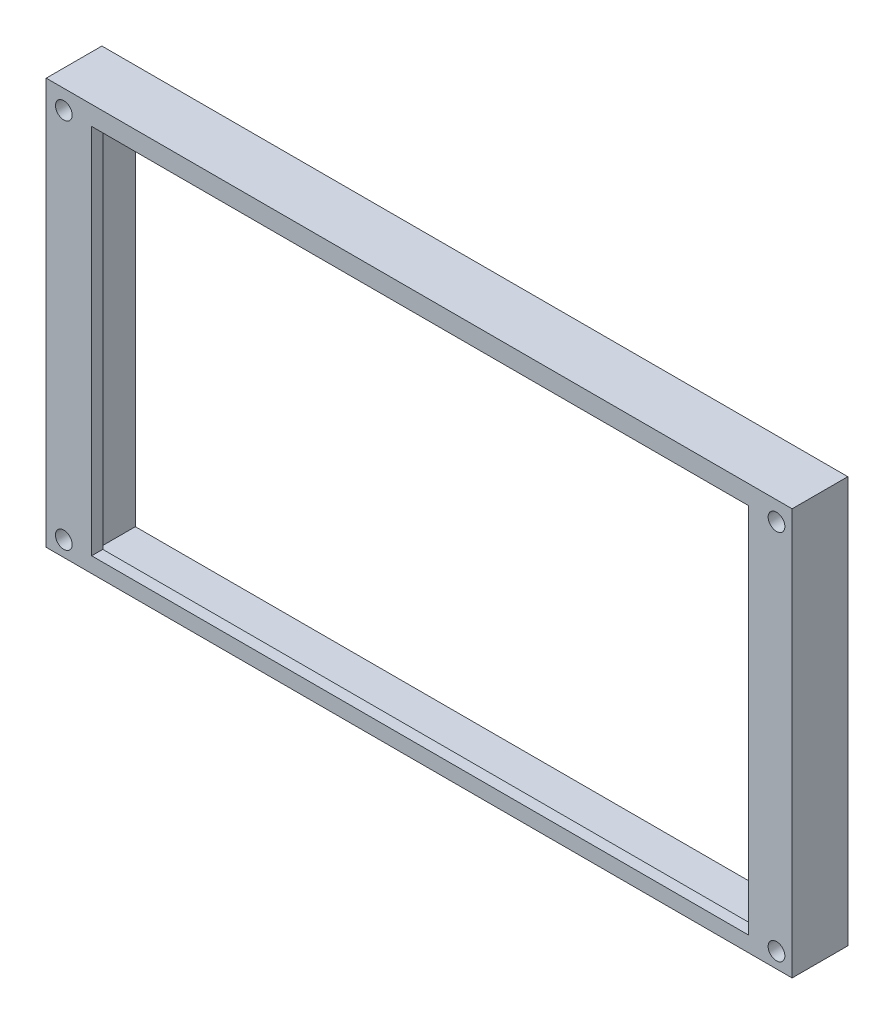
from build123d import *

# Parameters (mm, degrees)
SKETCH_1_W          = 126
SKETCH_1_H          = 73
SKETCH_1_W_2        = 122
SKETCH_1_H_2        = 70
EXTRUDE_1_DEPTH     = 8
SKETCH_5_W          = 126
SKETCH_5_H          = 73
SKETCH_5_W_2        = 118.02914008
SKETCH_5_H_2        = 66.805819456
EXTRUDE_2_DEPTH     = 2
SKETCH_7_W          = 4
SKETCH_7_H          = 73
EXTRUDE_3_DEPTH     = 2
SKETCH_8_W          = 4
SKETCH_8_H          = 73
EXTRUDE_5_DEPTH     = 2
SKETCH_10_W         = 4
SKETCH_10_H         = 73
EXTRUDE_6_DEPTH     = 5
SKETCH_12_W         = 4
SKETCH_12_H         = 73
EXTRUDE_7_DEPTH     = 3
CUT_EXTRUDE_1_DEPTH = 100.510141559


with BuildPart() as part:
    # 草图1 → 凸台-拉伸1 (new body)
    with BuildSketch(Plane.XY):
        with Locations((22.277543779, 6.299397776)):
            Rectangle(SKETCH_1_W, SKETCH_1_H)
        with Locations((22.29370516, 6.021928133)):
            Rectangle(SKETCH_1_W_2, SKETCH_1_H_2, mode=Mode.SUBTRACT)
    extrude(amount=-EXTRUDE_1_DEPTH)

    # 草图5 → 凸台-拉伸2 (add)
    with BuildSketch(Plane.XY):
        with Locations((22.277543779, 6.299397776)):
            Rectangle(SKETCH_5_W, SKETCH_5_H)
        with Locations((22.456070853, 5.970224549)):
            Rectangle(SKETCH_5_W_2, SKETCH_5_H_2, mode=Mode.SUBTRACT)
    extrude(amount=EXTRUDE_2_DEPTH)

    # 草图7 → 凸台-拉伸3 (add)
    with BuildSketch(Plane(origin=(0, 0, -8), x_dir=(-1, 0, 0), z_dir=(0, 0, -1))):
        with Locations((-87.277543779, 6.299397776)):
            Rectangle(SKETCH_7_W, SKETCH_7_H)
    extrude(amount=-EXTRUDE_3_DEPTH)

    # 草图8 → 凸台-拉伸5 (add)
    with BuildSketch(Plane(origin=(0, 0, -8), x_dir=(-1, 0, 0), z_dir=(0, 0, -1))):
        with Locations((42.722456221, 6.299397776)):
            Rectangle(SKETCH_8_W, SKETCH_8_H)
    extrude(amount=-EXTRUDE_5_DEPTH)

    # 草图10 → 凸台-拉伸6 (add)
    with BuildSketch(Plane.XY.offset(-6)):
        with Locations((87.277543779, 6.299397776)):
            Rectangle(SKETCH_10_W, SKETCH_10_H)
        with Locations((-42.722456221, 6.299397776)):
            Rectangle(SKETCH_10_W, SKETCH_10_H)
    extrude(amount=EXTRUDE_6_DEPTH)

    # 草图12 → 凸台-拉伸7 (add)
    with BuildSketch(Plane.XY.offset(-1)):
        with Locations((-42.722456221, 6.299397776)):
            Rectangle(SKETCH_12_W, SKETCH_12_H)
        with Locations((87.277543779, 6.299397776)):
            Rectangle(SKETCH_12_W, SKETCH_12_H)
    extrude(amount=EXTRUDE_7_DEPTH)

    # 草图13 → 切除-拉伸1 (cut, through all)
    with BuildSketch(Plane.XY.offset(2)):
        with BuildLine():
            ThreePointArc((87.970640893, -27.432685179), (87.531301065, -26.372025007), (86.470640893, -25.932685179))
            Line((86.470640893, -25.932685179), (86.470640893, -27.432685179))
            Line((86.470640893, -27.432685179), (84.970640893, -27.432685179))
            ThreePointArc((84.970640893, -27.432685179), (86.470640893, -28.932685179), (87.970640893, -27.432685179))
        make_face()
        with BuildLine():
            Line((86.470640893, -27.432685179), (86.470640893, -25.932685179))
            ThreePointArc((86.470640893, -25.932685179), (85.409980722, -26.372025007), (84.970640893, -27.432685179))
            Line((84.970640893, -27.432685179), (86.470640893, -27.432685179))
        make_face()
        with BuildLine():
            ThreePointArc((-40.058499187, -27.432685179), (-40.497839015, -26.372025007), (-41.558499187, -25.932685179))
            Line((-41.558499187, -25.932685179), (-41.558499187, -27.432685179))
            Line((-41.558499187, -27.432685179), (-40.058499187, -27.432685179))
        make_face()
        with BuildLine():
            Line((-41.558499187, -27.432685179), (-41.558499187, -25.932685179))
            ThreePointArc((-41.558499187, -25.932685179), (-42.619159359, -28.49334535), (-40.058499187, -27.432685179))
            Line((-40.058499187, -27.432685179), (-41.558499187, -27.432685179))
        make_face()
        with BuildLine():
            Line((-41.558499187, 37.873134277), (-41.558499187, 39.373134277))
            Line((-41.558499187, 39.373134277), (-40.058499187, 39.373134277))
            ThreePointArc((-40.058499187, 39.373134277), (-42.619159359, 40.433794449), (-41.558499187, 37.873134277))
        make_face()
        with BuildLine():
            Line((-40.058499187, 39.373134277), (-41.558499187, 39.373134277))
            Line((-41.558499187, 39.373134277), (-41.558499187, 37.873134277))
            ThreePointArc((-41.558499187, 37.873134277), (-40.497839015, 38.312474105), (-40.058499187, 39.373134277))
        make_face()
        with BuildLine():
            ThreePointArc((87.970640893, 39.373134277), (86.470640893, 40.873134277), (84.970640893, 39.373134277))
            Line((84.970640893, 39.373134277), (86.470640893, 39.373134277))
            Line((86.470640893, 39.373134277), (86.470640893, 37.873134277))
            ThreePointArc((86.470640893, 37.873134277), (87.531301065, 38.312474105), (87.970640893, 39.373134277))
        make_face()
        with BuildLine():
            Line((86.470640893, 39.373134277), (84.970640893, 39.373134277))
            ThreePointArc((84.970640893, 39.373134277), (85.409980722, 38.312474105), (86.470640893, 37.873134277))
            Line((86.470640893, 37.873134277), (86.470640893, 39.373134277))
        make_face()
    extrude(amount=-CUT_EXTRUDE_1_DEPTH, mode=Mode.SUBTRACT)


solid = part.part
